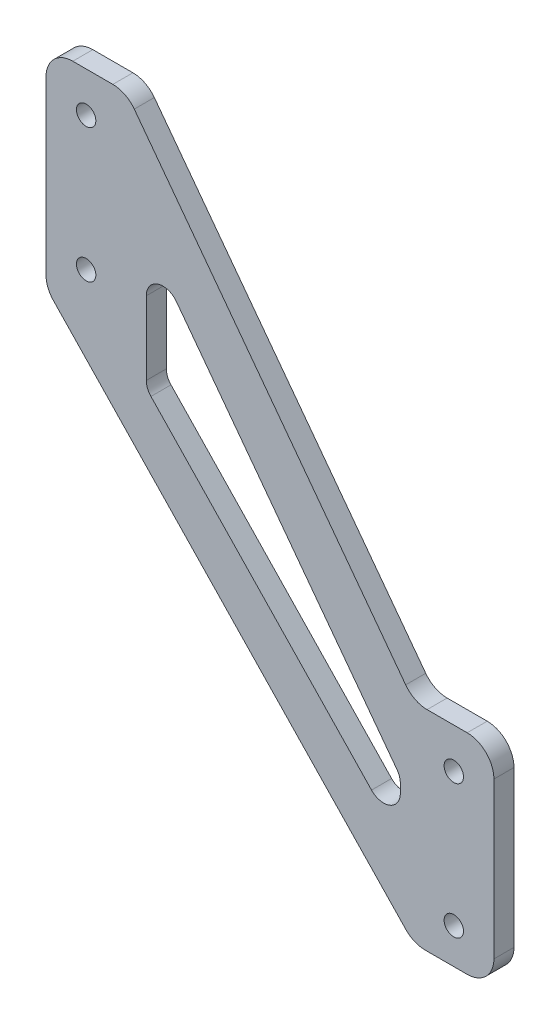
from build123d import *

# Parameters (mm, degrees)
SKETCH_1_R          = 1.45
EXTRUDE_1_DEPTH     = 3
CUT_EXTRUDE_1_DEPTH = 3
FILLET_1_R          = 4
FILLET_2_R          = 2.5


with BuildPart() as part:
    # 草图1 → 凸台-拉伸1 (new body)
    with BuildSketch(Plane.XY):
        Polygon((-49, 63.5), (-61, 63.5), (-61, 32.199032391), (-6, -25.300967609), (6, -25.300967609), (6, 6), (-6, 6), align=None)
        Circle(SKETCH_1_R, mode=Mode.SUBTRACT)
        with Locations((0, -20)):
            Circle(SKETCH_1_R, mode=Mode.SUBTRACT)
        with Locations((-55, 37.5)):
            Circle(SKETCH_1_R, mode=Mode.SUBTRACT)
        with Locations((-55, 57.5)):
            Circle(SKETCH_1_R, mode=Mode.SUBTRACT)
    extrude(amount=EXTRUDE_1_DEPTH)

    # 草图2 → 切除-拉伸1 (cut)
    with BuildSketch(Plane.XY.offset(3)):
        Polygon((-46, 46.130219602), (-46, 26.644197231), (-8, -13.083075497), (-8, -4.683733886), align=None)
    extrude(amount=-CUT_EXTRUDE_1_DEPTH, mode=Mode.SUBTRACT)

    # 圆角1
    fillet_1_edges = [part.edges().sort_by_distance(p)[0] for p in [
        (-6, 6, 1.5),
        (6, 6, 1.5),
        (6, -25.300967609, 1.5),
        (-6, -25.300967609, 1.5),
        (-61, 32.199032391, 1.5),
        (-61, 63.5, 1.5),
        (-49, 63.5, 1.5),
    ]]
    fillet(fillet_1_edges, radius=FILLET_1_R)

    # 圆角2
    fillet_2_edges = [part.edges().sort_by_distance(p)[0] for p in [
        (-46, 46.130219602, 1.5),
        (-8, -4.683733886, 1.5),
        (-8, -13.083075497, 1.5),
        (-46, 26.644197231, 1.5),
    ]]
    fillet(fillet_2_edges, radius=FILLET_2_R)


solid = part.part
